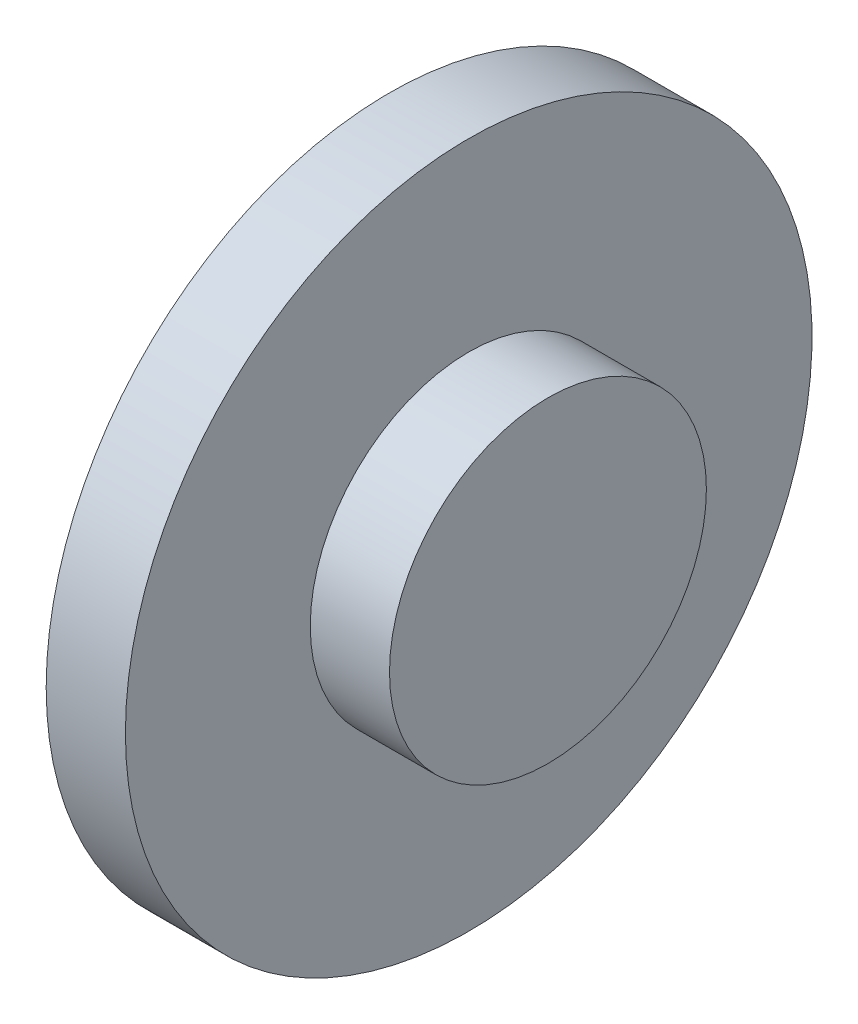
from build123d import *


with BuildPart() as part:
    # Эскиз1 → Повернуть1 (revolve)
    with BuildSketch(Plane.XY, mode=Mode.PRIVATE) as revolve_1_sk:
        Polygon((0, 0), (0, 13), (3, 13), (3, 6), (6, 6), (6, 0), align=None)
    revolve(revolve_1_sk.sketch.rotate(Axis((0, 0, 0), (1, 0, 0)), 90), axis=Axis((0, 0, 0), (1, 0, 0)))


solid = part.part
